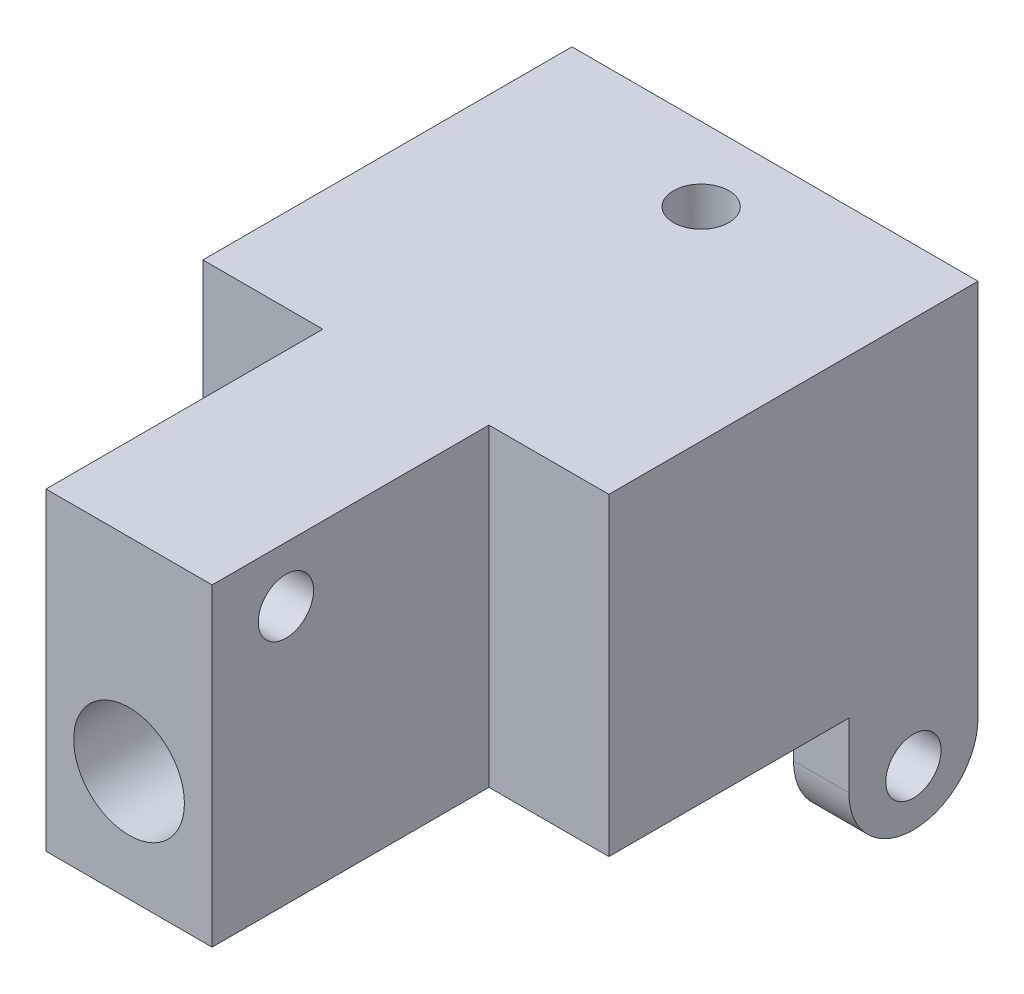
from build123d import *

# Parameters (mm, degrees)
DODANIE_WYCI_GNI_CIE1_DEPTH            = 7
WYTNIJ_WYCI_GNI_CIE1_REACH             = 28.495
WYTNIJ_WYCI_GNI_CIE2_REACH             = 28.495
SZKIC3_R                               = 1.5
SZKIC4_W                               = 22
SZKIC4_H                               = 17
DODANIE_WYCI_GNI_CIE2_DEPTH            = 20
SZKIC5_R                               = 3
WYTNIJ_WYCI_GNI_CIE3_DEPTH             = 20
WYTNIJ_WYCI_GNI_CIE4_DEPTH             = 2.5
WYTNIJ_WYCI_GNI_CIE5_REACH             = 30.46
SZKIC7_R                               = 1.5
WYTNIJ_WYCI_GNI_CIE5_DIRECTION_2_REACH = 30.46
DODANIE_WYCI_GNI_CIE3_START            = 15
SZKIC8_W                               = 9
SZKIC8_H                               = 17
SZKIC8_R                               = 3
DODANIE_WYCI_GNI_CIE3_DEPTH            = 15
SZKIC9_R                               = 1.5
WYTNIJ_WYCI_GNI_CIE6_DEPTH             = 9


with BuildPart() as part:
    # Szkic1 → Dodanie-wyciągnięcie1 (new body)
    with BuildSketch(Plane.XY):
        Polygon((8, 6), (-8, 6), (-11, 6), (-11, -13), (-8, -13), (-8, -6), (8, -6), (8, -13), (11, -13), (11, 6), align=None)
    extrude(amount=DODANIE_WYCI_GNI_CIE1_DEPTH)

    # Wytnij-wyciągnięcie1: up to this face of the body (flat: up to its plane)
    wytnij_wyci_gni_cie1_end = Plane(part.part.faces().sort_by_distance((11, -3.5, 3.5))[0])
    # Szkic2 → Wytnij-wyciągnięcie1 (cut, up to the picked face)
    with BuildSketch(Plane.ZY.offset(11), mode=Mode.PRIVATE) as wytnij_wyci_gni_cie1_sk1:
        with BuildLine():
            ThreePointArc((7, -9.5), (5.974873734, -11.974873734), (3.5, -13))
            Line((3.5, -13), (7, -13))
            Line((7, -13), (7, -9.5))
        make_face()
    wytnij_wyci_gni_cie1_tool1 = split(extrude(wytnij_wyci_gni_cie1_sk1.sketch, amount=-WYTNIJ_WYCI_GNI_CIE1_REACH, mode=Mode.PRIVATE), bisect_by=wytnij_wyci_gni_cie1_end, keep=Keep.BOTH, mode=Mode.PRIVATE)
    # Szkic2 → Wytnij-wyciągnięcie1 (cut, up to the picked face)
    with BuildSketch(Plane.ZY.offset(11), mode=Mode.PRIVATE) as wytnij_wyci_gni_cie1_sk2:
        with BuildLine():
            ThreePointArc((3.5, -13), (1.025126266, -11.974873734), (0, -9.5))
            Line((0, -9.5), (0, -13))
            Line((0, -13), (3.5, -13))
        make_face()
    wytnij_wyci_gni_cie1_tool2 = split(extrude(wytnij_wyci_gni_cie1_sk2.sketch, amount=-WYTNIJ_WYCI_GNI_CIE1_REACH, mode=Mode.PRIVATE), bisect_by=wytnij_wyci_gni_cie1_end, keep=Keep.BOTH, mode=Mode.PRIVATE)
    add(wytnij_wyci_gni_cie1_tool1.solids().sort_by(Axis((-11, -12.218212, 6.218212), (1, 0, 0)))[0], mode=Mode.SUBTRACT)
    add(wytnij_wyci_gni_cie1_tool2.solids().sort_by(Axis((-11, -12.218212, 0.781788), (1, 0, 0)))[0], mode=Mode.SUBTRACT)

    # Wytnij-wyciągnięcie2: up to this face of the body (flat: up to its plane)
    wytnij_wyci_gni_cie2_end = Plane(part.part.faces().sort_by_distance((11, -3.141167, 3.5))[0])
    # Szkic3 → Wytnij-wyciągnięcie2 (cut, up to the picked face)
    with BuildSketch(Plane.ZY.offset(11), mode=Mode.PRIVATE) as wytnij_wyci_gni_cie2_sk1:
        with Locations(Location((3.5, -10, 0), (0, 0, 270))):
            Circle(SZKIC3_R)
    wytnij_wyci_gni_cie2_tool1 = split(extrude(wytnij_wyci_gni_cie2_sk1.sketch, amount=-WYTNIJ_WYCI_GNI_CIE2_REACH, mode=Mode.PRIVATE), bisect_by=wytnij_wyci_gni_cie2_end, keep=Keep.BOTH, mode=Mode.PRIVATE)
    add(wytnij_wyci_gni_cie2_tool1.solids().sort_by(Axis((-11, -10, 3.5), (1, 0, 0)))[0], mode=Mode.SUBTRACT)

    # Szkic4 → Dodanie-wyciągnięcie2 (add)
    with BuildSketch(Plane(origin=(0, 0, 0), x_dir=(-1, 0, 0), z_dir=(0, 0, -1))):
        with Locations((0, 2.5)):
            Rectangle(SZKIC4_W, SZKIC4_H)
    extrude(amount=-DODANIE_WYCI_GNI_CIE2_DEPTH)

    # Szkic5 → Wytnij-wyciągnięcie3 (cut)
    with BuildSketch(Plane.XY.offset(20)):
        Circle(SZKIC5_R)
    extrude(amount=-WYTNIJ_WYCI_GNI_CIE3_DEPTH, mode=Mode.SUBTRACT)

    # Szkic6 → Wytnij-wyciągnięcie4 (cut)
    with BuildSketch(Plane(origin=(0, 4, 0), x_dir=(-1, 0, 0), z_dir=(0, -1, 0))):
        Polygon((2.65, -2.316843521), (2.65, 0), (-2.65, 0), (-2.65, -2.316843521), (-2.65, -5.376799948), (0, -6.906778161), (2.65, -5.376799948), align=None)
    extrude(amount=-WYTNIJ_WYCI_GNI_CIE4_DEPTH, mode=Mode.SUBTRACT)

    # Szkic7 → Wytnij-wyciągnięcie5 (cut, up to next)
    with BuildSketch(Plane(origin=(0, 4, 0), x_dir=(1, 0, 0), z_dir=(0, 1, 0)), mode=Mode.PRIVATE) as wytnij_wyci_gni_cie5_sk1:
        with Locations(Location((0, -4, 0), (0, 0, 270))):
            Circle(SZKIC7_R)
    wytnij_wyci_gni_cie5_tool1 = extrude(wytnij_wyci_gni_cie5_sk1.sketch, amount=-WYTNIJ_WYCI_GNI_CIE5_REACH, mode=Mode.PRIVATE) & part.part
    add(wytnij_wyci_gni_cie5_tool1.solids().sort_by_distance((0, 4, 4))[0], mode=Mode.SUBTRACT)

    # Szkic7 → Wytnij-wyciągnięcie5 direction 2 (cut, up to next)
    with BuildSketch(Plane(origin=(0, 4, 0), x_dir=(1, 0, 0), z_dir=(0, 1, 0)), mode=Mode.PRIVATE) as wytnij_wyci_gni_cie5_direction_2_sk1:
        with Locations(Location((0, -4, 0), (0, 0, 270))):
            Circle(SZKIC7_R)
    wytnij_wyci_gni_cie5_direction_2_tool1 = extrude(wytnij_wyci_gni_cie5_direction_2_sk1.sketch, amount=WYTNIJ_WYCI_GNI_CIE5_DIRECTION_2_REACH, mode=Mode.PRIVATE) & part.part
    add(wytnij_wyci_gni_cie5_direction_2_tool1.solids().sort_by_distance((0, 4, 4))[0], mode=Mode.SUBTRACT)

    # Szkic8 → Dodanie-wyciągnięcie3 (add)
    with BuildSketch(Plane.XY.offset(20).offset(DODANIE_WYCI_GNI_CIE3_START)):
        with Locations((0, 2.5)):
            Rectangle(SZKIC8_W, SZKIC8_H)
        Circle(SZKIC8_R, mode=Mode.SUBTRACT)
    extrude(amount=-DODANIE_WYCI_GNI_CIE3_DEPTH)

    # Szkic9 → Wytnij-wyciągnięcie6 (cut)
    with BuildSketch(Plane(origin=(4.5, 0, 0), x_dir=(0, 0, -1), z_dir=(1, 0, 0))):
        with Locations(Location((-31, 8, 0), (0, 0, 90))):
            Circle(SZKIC9_R)
    extrude(amount=-WYTNIJ_WYCI_GNI_CIE6_DEPTH, mode=Mode.SUBTRACT)


solid = part.part
